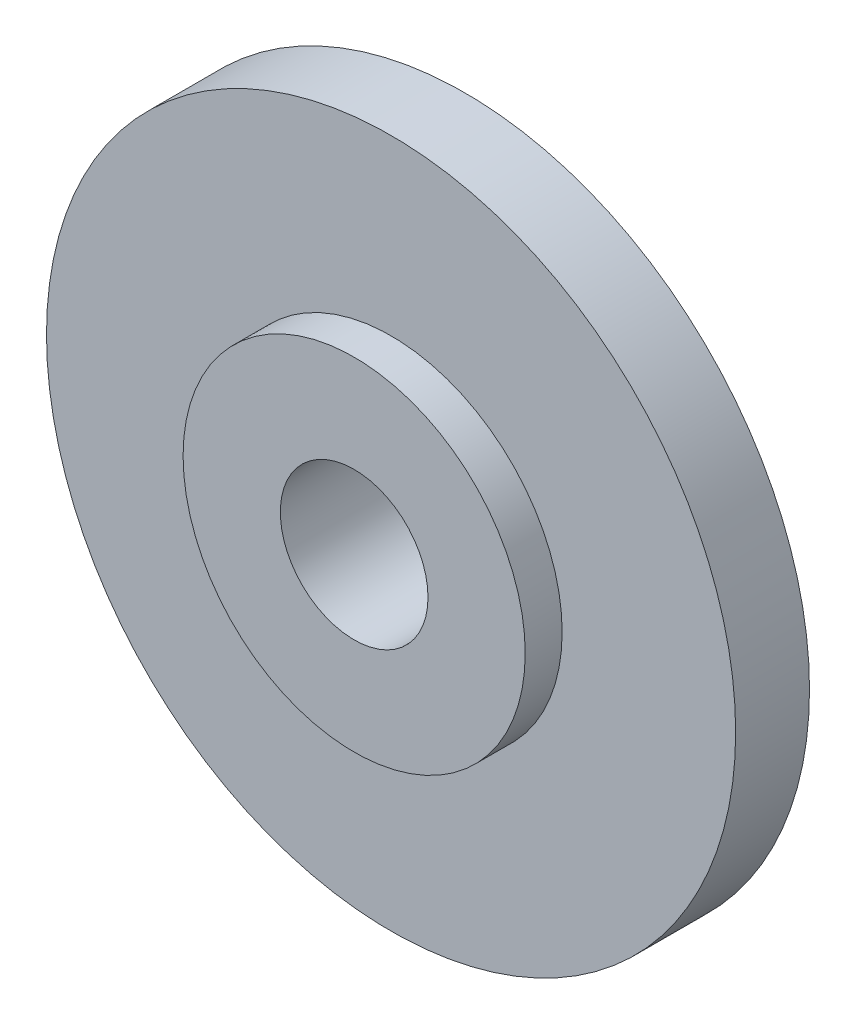
from build123d import *

# Parameters (mm, degrees)
SKETCH1_R           = 14
BOSS_EXTRUDE1_DEPTH = 3
SKETCH2_R           = 6.95
BOSS_EXTRUDE2_DEPTH = 1.5
SKETCH3_R           = 3
CUT_EXTRUDE1_DEPTH  = 21.303940504


with BuildPart() as part:
    # Sketch1 → Boss-Extrude1 (new body)
    with BuildSketch(Plane.XY):
        Circle(SKETCH1_R)
    extrude(amount=BOSS_EXTRUDE1_DEPTH)

    # Sketch2 → Boss-Extrude2 (add)
    with BuildSketch(Plane.XY.offset(3)):
        Circle(SKETCH2_R)
    extrude(amount=BOSS_EXTRUDE2_DEPTH)

    # Sketch3 → Cut-Extrude1 (cut, through all)
    with BuildSketch(Plane.XY.offset(4.5)):
        Circle(SKETCH3_R)
    extrude(amount=-CUT_EXTRUDE1_DEPTH, mode=Mode.SUBTRACT)


solid = part.part
